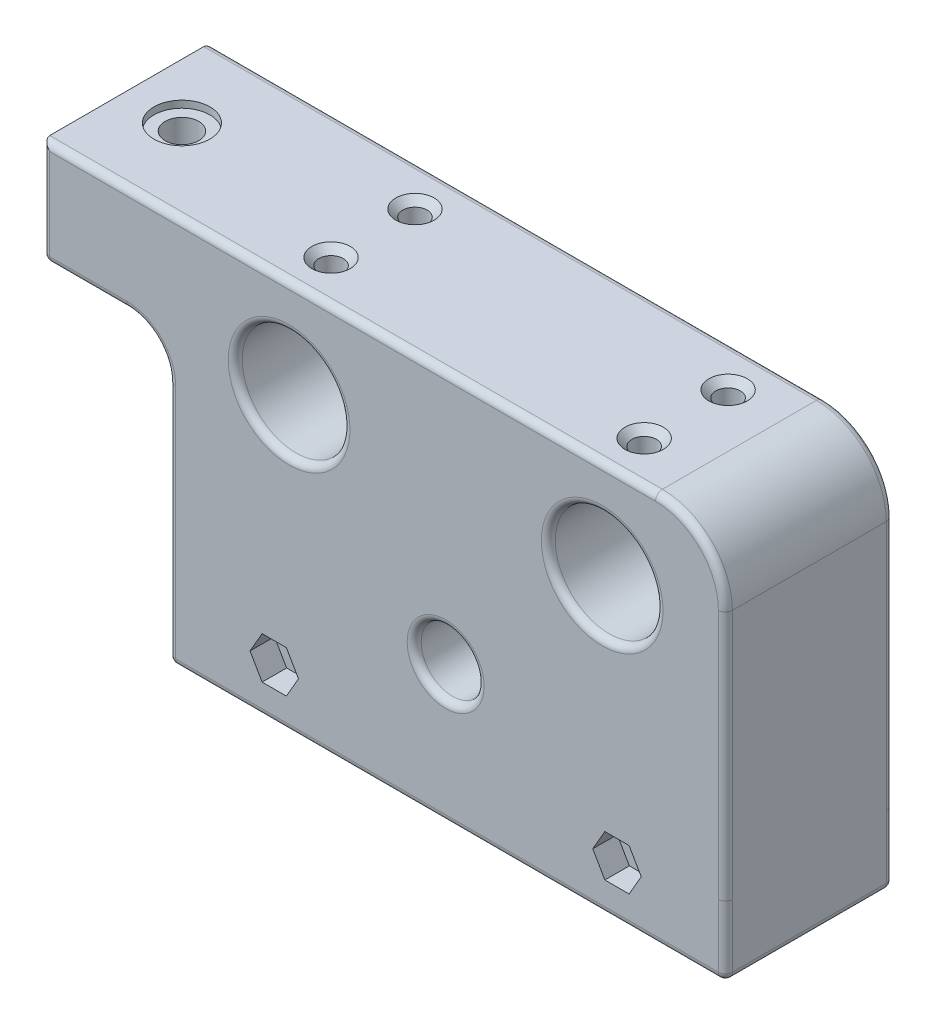
from build123d import *

# Parameters (mm, degrees)
CROQUIS1_W               = 80
CROQUIS1_H               = 46.8
SALIENTE_EXTRUIR1_DEPTH  = 24
CROQUIS2_R               = 7.7
CORTAR_EXTRUIR1_DEPTH    = 96.740482556
CROQUIS3_W               = 9.5
CROQUIS3_H               = 7
CORTAR_EXTRUIR2_DEPTH    = 15.3
CORTAR_EXTRUIR3_DEPTH    = 6
CROQUIS5_R               = 4.5
CORTAR_EXTRUIR4_DEPTH    = 95.415253005
CROQUIS6_W               = 24
CROQUIS6_H               = 46.8
SALIENTE_EXTRUIR2_DEPTH  = 32.604606
CHAFL_N1_SIZE            = 15
CHAFL_N1_SIZE2           = 31
REDONDEO3_R              = 10
CROQUIS13_W              = 17.316285927
CROQUIS13_H              = 46.8
CORTAR_EXTRUIR7_DEPTH    = 51
REDONDEO7_R              = 1
BOSS_EXTRUDE1_START      = 6
SKETCH1_R                = 4.5
BOSS_EXTRUDE1_DEPTH      = 6
BOSS_EXTRUDE2_DEPTH      = 2.5
BOSS_EXTRUDE2_DEPTH_BACK = 1
SKETCH2_R                = 4.5
SKETCH4_R                = 5.25
SKETCH4_R_2              = 4.5
CUT_EXTRUDE1_DEPTH       = 10.3
SKETCH6_R                = 1.75
CUT_EXTRUDE3_DEPTH       = 10
CUT_EXTRUDE4_START       = -3.5
SKETCH6_3_R              = 1.75
CUT_EXTRUDE4_DEPTH       = 10
SKETCH7_W                = 21
SKETCH7_H                = 35
CUT_EXTRUDE5_DEPTH       = 96.740482639
SKETCH8_R                = 2.4
CUT_EXTRUDE6_DEPTH       = 96.740482688
SKETCH8_3_R              = 4
SKETCH8_3_R_2            = 2.4
CUT_EXTRUDE7_DEPTH       = 1
FILLET2_R                = 6
SKETCH5_R                = 1.5
CORTAR_EXTRUIR14_DEPTH   = 8
CHAFL_N2_SIZE            = 1
CROQUIS18_W              = 79.60460618
CROQUIS18_H              = 24
CROQUIS18_W_2            = 9.5
CROQUIS18_H_2            = 7
SALIENTE_EXTRUIR3_DEPTH  = 10
CROQUIS19_R              = 2.9
CORTAR_EXTRUIR15_DEPTH   = 10
CROQUIS20_R              = 1.75
CORTAR_EXTRUIR16_DEPTH   = 30
CORTAR_EXTRUIR17_DEPTH   = 3.5
REDONDEO10_R             = 1


with BuildPart() as part:
    # Croquis1 → Saliente-Extruir1 (new body)
    with BuildSketch(Plane.XY):
        with Locations((40, 23.4)):
            Rectangle(CROQUIS1_W, CROQUIS1_H)
    extrude(amount=SALIENTE_EXTRUIR1_DEPTH)

    # Croquis2 → Cortar-Extruir1 (cut, through all)
    with BuildSketch(Plane(origin=(0, 0, 0), x_dir=(-1, 0, 0), z_dir=(0, 0, -1))):
        with Locations((-17.617478636, 32.8)):
            Circle(CROQUIS2_R)
        with Locations((-62.382521364, 32.8)):
            Circle(CROQUIS2_R)
    extrude(amount=-CORTAR_EXTRUIR1_DEPTH, mode=Mode.SUBTRACT)

    # Croquis3 → Cortar-Extruir2 (cut)
    with BuildSketch(Plane(origin=(0, 0, 0), x_dir=(-1, 0, 0), z_dir=(0, -1, 0))):
        with Locations((-64.5, -12)):
            Rectangle(CROQUIS3_W, CROQUIS3_H)
        with Locations((-15.5, -12)):
            Rectangle(CROQUIS3_W, CROQUIS3_H)
    extrude(amount=-CORTAR_EXTRUIR2_DEPTH, mode=Mode.SUBTRACT)

    # Croquis4 → Cortar-Extruir3 (cut)
    with BuildSketch(Plane(origin=(0, 0, 0), x_dir=(-1, 0, 0), z_dir=(0, 0, -1))):
        Polygon((-43.839379291, 17.30000002), (-47.678758581, 10.65000002), (-43.839379291, 4.00000002), (-36.160620711, 4.00000002), (-32.321241421, 10.65000002), (-36.160620711, 17.30000002), align=None)
    extrude(amount=-CORTAR_EXTRUIR3_DEPTH, mode=Mode.SUBTRACT)

    # Croquis5 → Cortar-Extruir4 (cut, through all)
    with BuildSketch(Plane(origin=(0, 0, 6), x_dir=(-1, 0, 0), z_dir=(0, 0, -1))):
        with Locations((-40.000000001, 10.65000002)):
            Circle(CROQUIS5_R)
    extrude(amount=-CORTAR_EXTRUIR4_DEPTH, mode=Mode.SUBTRACT)

    # Croquis6 → Saliente-Extruir2 (add)
    with BuildSketch(Plane.ZY):
        with Locations((12, 23.4)):
            Rectangle(CROQUIS6_W, CROQUIS6_H)
    extrude(amount=SALIENTE_EXTRUIR2_DEPTH)

    # Chaflán1
    chafl_n1_edges = [part.edges().sort_by_distance(p)[0] for p in [
        (-32.604606, 0, 12),
    ]]
    chafl_n1_side = [part.faces().sort_by_distance(p)[0] for p in [
        (22.853876256, 0, 12),
    ]]
    chamfer(chafl_n1_edges, length=CHAFL_N1_SIZE, length2=CHAFL_N1_SIZE2, reference=chafl_n1_side[0])

    # Redondeo3
    redondeo3_edges = [part.edges().sort_by_distance(p)[0] for p in [
        (-32.604606, 46.8, 12),
        (80, 46.8, 12),
    ]]
    fillet(redondeo3_edges, radius=REDONDEO3_R)

    # Croquis13 → Cortar-Extruir7 (cut)
    with BuildSketch(Plane(origin=(0, 0, 0), x_dir=(-1, 0, 0), z_dir=(0, 0, -1))):
        with Locations((26.262749144, 23.4)):
            Rectangle(CROQUIS13_W, CROQUIS13_H)
    extrude(amount=-CORTAR_EXTRUIR7_DEPTH, mode=Mode.SUBTRACT)

    # Redondeo7
    redondeo7_edges = [part.edges().sort_by_distance(p)[0] for p in [
        (80, 18.4, 24),
        (-17.60460618, 23.4, 24),
        (-17.60460618, 23.4, 0),
        (25.317478636, 32.8, 24),
        (25.317478636, 32.8, 0),
        (70.082521364, 32.8, 24),
        (70.082521364, 32.8, 0),
        (80, 18.4, 0),
        (40.000000001, 17.30000002, 0),
        (45.759068936, 13.97500002, 0),
        (45.759068936, 7.32500002, 0),
        (40.000000001, 4.00000002, 0),
        (34.240931066, 7.32500002, 0),
        (34.240931066, 13.97500002, 0),
        (44.500000001, 10.65000002, 24),
        (31.197697, 0, 24),
        (31.197697, 0, 0),
        (26.19769691, 46.8, 0),
        (77.071067812, 43.871067812, 0),
        (26.19769691, 46.8, 24),
        (77.071067812, 43.871067812, 24),
    ]]
    fillet(redondeo7_edges, radius=REDONDEO7_R)

    # Sketch1 → Boss-Extrude1 (add)
    with BuildSketch(Plane(origin=(0, 0, 6), x_dir=(-1, 0, 0), z_dir=(0, 0, -1)).offset(BOSS_EXTRUDE1_START)):
        Polygon((-44.41672956, 18.30000002), (-48.83345912, 10.65000002), (-44.41672956, 3.00000002), (-35.583270442, 3.00000002), (-31.166540882, 10.65000002), (-35.583270442, 18.30000002), align=None)
        with Locations((-40.000000001, 10.65000002)):
            Circle(SKETCH1_R, mode=Mode.SUBTRACT)
    extrude(amount=-BOSS_EXTRUDE1_DEPTH)

    # Sketch2 → Boss-Extrude2 (add, two sides: drawn at the far end of the back side and taken through both)
    with BuildSketch(Plane(origin=(0, 0, 0), x_dir=(-1, 0, 0), z_dir=(0, 0, -1)).offset(-BOSS_EXTRUDE2_DEPTH_BACK)):
        with BuildLine():
            ThreePointArc((-35.861461658, 1), (-40.000000001, 21.15000002), (-44.138538344, 1))
            ThreePointArc((-44.138538344, 1), (-40.000000001, 0.15000002), (-35.861461658, 1))
        make_face()
        with Locations((-40.000000001, 10.65000002)):
            Circle(SKETCH2_R, mode=Mode.SUBTRACT)
    extrude(amount=BOSS_EXTRUDE2_DEPTH + BOSS_EXTRUDE2_DEPTH_BACK)

    # Sketch4 → Cut-Extrude1 (cut)
    with BuildSketch(Plane(origin=(0, 0, -2.5), x_dir=(-1, 0, 0), z_dir=(0, 0, -1))):
        with Locations((-40.000000001, 10.65000002)):
            Circle(SKETCH4_R)
        with Locations((-40.000000001, 10.65000002)):
            Circle(SKETCH4_R_2, mode=Mode.SUBTRACT)
    extrude(amount=-CUT_EXTRUDE1_DEPTH, mode=Mode.SUBTRACT)

    # Sketch6 → Cut-Extrude3 (cut)
    with BuildSketch(Plane(origin=(0, 46.8, 0), x_dir=(1, 0, 0), z_dir=(0, 1, 0))):
        with Locations(Location((17.61539382, -6, 0), (0, 0, 270))):
            Circle(SKETCH6_R)
        with Locations(Location((17.61539382, -18, 0), (0, 0, 270))):
            Circle(SKETCH6_R)
        with Locations(Location((62.38539382, -18, 0), (0, 0, 270))):
            Circle(SKETCH6_R)
        with Locations(Location((62.38539382, -6, 0), (0, 0, 270))):
            Circle(SKETCH6_R)
    extrude(amount=-CUT_EXTRUDE3_DEPTH, mode=Mode.SUBTRACT)

    # Sketch6<3> → Cut-Extrude4 (cut)
    # profile 1 of 8: a face of its own
    with BuildSketch(Plane(origin=(0, 46.8, 0), x_dir=(1, 0, 0), z_dir=(0, 1, 0)).offset(CUT_EXTRUDE4_START)):
        Polygon((14.151292205, -6), (15.883343012, -9), (19.347444627, -9), (21.079495435, -6), (19.347444627, -3), (15.883343012, -3), align=None)
        with Locations(Location((17.61539382, -6, 0), (0, 0, 270))):
            Circle(SKETCH6_3_R, mode=Mode.SUBTRACT)
    # profile 2 of 8: a face of its own
    with BuildSketch(Plane(origin=(0, 46.8, 0), x_dir=(1, 0, 0), z_dir=(0, 1, 0)).offset(CUT_EXTRUDE4_START)):
        with Locations(Location((17.61539382, -6, 0), (0, 0, 270))):
            Circle(SKETCH6_3_R)
    # profile 3 of 8: a face of its own
    with BuildSketch(Plane(origin=(0, 46.8, 0), x_dir=(1, 0, 0), z_dir=(0, 1, 0)).offset(CUT_EXTRUDE4_START)):
        Polygon((14.151292205, -18), (15.883343012, -21), (19.347444627, -21), (21.079495435, -18), (19.347444627, -15), (15.883343012, -15), align=None)
        with Locations(Location((17.61539382, -18, 0), (0, 0, 270))):
            Circle(SKETCH6_3_R, mode=Mode.SUBTRACT)
    # profile 4 of 8: a face of its own
    with BuildSketch(Plane(origin=(0, 46.8, 0), x_dir=(1, 0, 0), z_dir=(0, 1, 0)).offset(CUT_EXTRUDE4_START)):
        with Locations(Location((17.61539382, -18, 0), (0, 0, 270))):
            Circle(SKETCH6_3_R)
    # profile 5 of 8: a face of its own
    with BuildSketch(Plane(origin=(0, 46.8, 0), x_dir=(1, 0, 0), z_dir=(0, 1, 0)).offset(CUT_EXTRUDE4_START)):
        Polygon((58.921292205, -6), (60.653343012, -9), (64.117444627, -9), (65.849495435, -6), (64.117444627, -3), (60.653343012, -3), align=None)
        with Locations(Location((62.38539382, -6, 0), (0, 0, 270))):
            Circle(SKETCH6_3_R, mode=Mode.SUBTRACT)
    # profile 6 of 8: a face of its own
    with BuildSketch(Plane(origin=(0, 46.8, 0), x_dir=(1, 0, 0), z_dir=(0, 1, 0)).offset(CUT_EXTRUDE4_START)):
        with Locations(Location((62.38539382, -6, 0), (0, 0, 270))):
            Circle(SKETCH6_3_R)
    # profile 7 of 8: a face of its own
    with BuildSketch(Plane(origin=(0, 46.8, 0), x_dir=(1, 0, 0), z_dir=(0, 1, 0)).offset(CUT_EXTRUDE4_START)):
        Polygon((58.921292205, -18), (60.653343012, -21), (64.117444627, -21), (65.849495435, -18), (64.117444627, -15), (60.653343012, -15), align=None)
        with Locations(Location((62.38539382, -18, 0), (0, 0, 270))):
            Circle(SKETCH6_3_R, mode=Mode.SUBTRACT)
    # profile 8 of 8: a face of its own
    with BuildSketch(Plane(origin=(0, 46.8, 0), x_dir=(1, 0, 0), z_dir=(0, 1, 0)).offset(CUT_EXTRUDE4_START)):
        with Locations(Location((62.38539382, -18, 0), (0, 0, 270))):
            Circle(SKETCH6_3_R)
    extrude(amount=-CUT_EXTRUDE4_DEPTH, mode=Mode.SUBTRACT)

    # Sketch7 → Cut-Extrude5 (cut, through all)
    with BuildSketch(Plane(origin=(0, 0, 0), x_dir=(-1, 0, 0), z_dir=(0, 0, -1))):
        with Locations((10.10460618, 14.3)):
            Rectangle(SKETCH7_W, SKETCH7_H)
    extrude(amount=-CUT_EXTRUDE5_DEPTH, mode=Mode.SUBTRACT)

    # Sketch8 → Cut-Extrude6 (cut, through all)
    with BuildSketch(Plane(origin=(0, 46.8, 0), x_dir=(1, 0, 0), z_dir=(0, 1, 0))):
        with Locations(Location((-9.70460618, -12, 0), (0, 0, 270))):
            Circle(SKETCH8_R)
    extrude(amount=-CUT_EXTRUDE6_DEPTH, mode=Mode.SUBTRACT)

    # Sketch8<3> → Cut-Extrude7 (cut)
    with BuildSketch(Plane(origin=(0, 46.8, 0), x_dir=(1, 0, 0), z_dir=(0, 1, 0))):
        with Locations(Location((-9.70460618, -12, 0), (0, 0, 270))):
            Circle(SKETCH8_3_R)
        with Locations(Location((-9.70460618, -12, 0), (0, 0, 270))):
            Circle(SKETCH8_3_R_2, mode=Mode.SUBTRACT)
    extrude(amount=-CUT_EXTRUDE7_DEPTH, mode=Mode.SUBTRACT)

    # Fillet2
    fillet2_edges = [part.edges().sort_by_distance(p)[0] for p in [
        (0.39539382, 31.8, 12),
    ]]
    fillet(fillet2_edges, radius=FILLET2_R)

    # Sketch5 → Cortar-Extruir14 (cut)
    with BuildSketch(Plane(origin=(0, 0, -2.5), x_dir=(-1, 0, 0), z_dir=(0, 0, -1))):
        with Locations((-34.307790413, 16.342209609)):
            Circle(SKETCH5_R)
        with Locations((-34.307790413, 4.957790431)):
            Circle(SKETCH5_R)
        with Locations((-45.69220959, 4.957790431)):
            Circle(SKETCH5_R)
        with Locations((-45.69220959, 16.342209609)):
            Circle(SKETCH5_R)
    extrude(amount=-CORTAR_EXTRUIR14_DEPTH, mode=Mode.SUBTRACT)

    # Chaflán2
    chafl_n2_edges = [part.edges().sort_by_distance(p)[0] for p in [
        (17.61539382, 46.8, 4.25),
        (17.61539382, 46.8, 16.25),
        (62.38539382, 46.8, 16.25),
        (62.38539382, 46.8, 4.25),
    ]]
    chamfer(chafl_n2_edges, length=CHAFL_N2_SIZE)

    # Croquis18 → Saliente-Extruir3 (add)
    with BuildSketch(Plane(origin=(0, 1, 0), x_dir=(-1, 0, 0), z_dir=(0, -1, 0))):
        with Locations((-40.19769691, -12)):
            Rectangle(CROQUIS18_W, CROQUIS18_H)
        with Locations((-64.5, -12)):
            Rectangle(CROQUIS18_W_2, CROQUIS18_H_2, mode=Mode.SUBTRACT)
        with Locations((-15.5, -12)):
            Rectangle(CROQUIS18_W_2, CROQUIS18_H_2, mode=Mode.SUBTRACT)
    extrude(amount=SALIENTE_EXTRUIR3_DEPTH)

    # Croquis19 → Cortar-Extruir15 (cut)
    with BuildSketch(Plane(origin=(0, 0, 0), x_dir=(-1, 0, 0), z_dir=(0, 0, -1))):
        with Locations((-64.5, -1.7)):
            Circle(CROQUIS19_R)
        with Locations((-15.49539382, -1.7)):
            Circle(CROQUIS19_R)
    extrude(amount=-CORTAR_EXTRUIR15_DEPTH, mode=Mode.SUBTRACT)

    # Croquis20 → Cortar-Extruir16 (cut)
    with BuildSketch(Plane(origin=(0, 0, 0), x_dir=(-1, 0, 0), z_dir=(0, 0, -1))):
        with Locations((-64.5, -1.7)):
            Circle(CROQUIS20_R)
        with Locations((-15.49539382, -1.7)):
            Circle(CROQUIS20_R)
    extrude(amount=-CORTAR_EXTRUIR16_DEPTH, mode=Mode.SUBTRACT)

    # Croquis21 → Cortar-Extruir17 (cut)
    with BuildSketch(Plane.XY.offset(24)):
        Polygon((18.959495435, -1.7), (17.227444627, 1.3), (13.763343012, 1.3), (12.031292205, -1.7), (13.763343012, -4.7), (17.227444627, -4.7), align=None)
        Polygon((67.964101615, -1.7), (66.232050808, 1.3), (62.767949192, 1.3), (61.035898385, -1.7), (62.767949192, -4.7), (66.232050808, -4.7), align=None)
    extrude(amount=-CORTAR_EXTRUIR17_DEPTH, mode=Mode.SUBTRACT)

    # Redondeo10
    redondeo10_edges = [part.edges().sort_by_distance(p)[0] for p in [
        (0.39539382, 8.4, 24),
        (-1.361965493, 30.042640687, 24),
        (-11.10460618, 31.8, 24),
        (-17.311712961, 31.8, 23.707106781),
        (-17.60460618, 31.8, 12),
        (-17.311712961, 31.8, 0.292893219),
        (-11.10460618, 31.8, 0),
        (-1.361965493, 30.042640687, 0),
        (40.19769691, -9, 24),
        (80, -9, 12),
        (40.19769691, -9, 0),
        (0.39539382, -9, 12),
        (35.861461658, 20.30000004, 0),
        (0.39539382, 8.4, 0),
        (80, -4, 24),
        (80, -4, 0),
        (18.39539382, -1.7, 0),
        (67.4, -1.7, 0),
        (15.5, -9, 15.5),
        (10.75, -9, 12),
        (15.5, -9, 8.5),
        (20.25, -9, 12),
        (64.5, -9, 15.5),
        (59.75, -9, 12),
        (64.5, -9, 8.5),
        (69.25, -9, 12),
    ]]
    fillet(redondeo10_edges, radius=REDONDEO10_R)


solid = part.part
